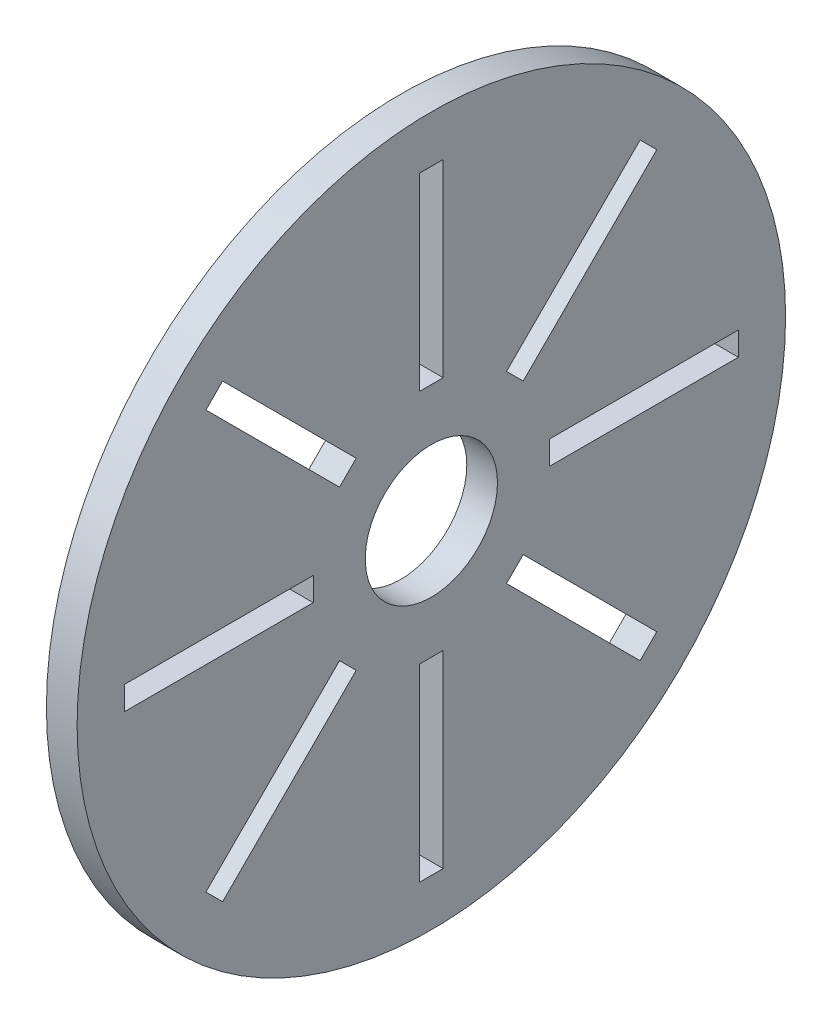
from build123d import *

# Parameters (mm, degrees)
SKETCH1_R           = 15
BOSS_EXTRUDE1_DEPTH = 1.3
SKETCH2_R           = 2.8
CUT_EXTRUDE1_DEPTH  = 22.252999788
SKETCH3_W           = 1
SKETCH3_H           = 8
SKETCH3_W_2         = 8
SKETCH3_H_2         = 1
CUT_EXTRUDE2_DEPTH  = 22.252999788


with BuildPart() as part:
    # Sketch1 → Boss-Extrude1 (new body)
    with BuildSketch(Plane(origin=(0, 0, 0), x_dir=(0, 0, -1), z_dir=(1, 0, 0))):
        Circle(SKETCH1_R)
    extrude(amount=BOSS_EXTRUDE1_DEPTH)

    # Sketch2 → Cut-Extrude1 (cut, through all)
    with BuildSketch(Plane(origin=(1.3, 0, 0), x_dir=(0, 0, -1), z_dir=(1, 0, 0))):
        Circle(SKETCH2_R)
    extrude(amount=-CUT_EXTRUDE1_DEPTH, mode=Mode.SUBTRACT)

    # Sketch3 → Cut-Extrude2 (cut, through all)
    with BuildSketch(Plane(origin=(1.3, 0, 0), x_dir=(0, 0, -1), z_dir=(1, 0, 0))):
        Polygon((-8.838834765, -9.545941546), (-3.181980515, -3.889087297), (-3.889087297, -3.181980515), (-9.545941546, -8.838834765), align=None)
        Polygon((9.545941546, -8.838834765), (3.889087297, -3.181980515), (3.181980515, -3.889087297), (8.838834765, -9.545941546), align=None)
        Polygon((-9.545941546, 8.838834765), (-3.889087297, 3.181980515), (-3.181980515, 3.889087297), (-8.838834765, 9.545941546), align=None)
        Polygon((9.545941546, 8.838834765), (3.889087297, 3.181980515), (3.181980515, 3.889087297), (8.838834765, 9.545941546), align=None)
        with Locations((0, 9)):
            Rectangle(SKETCH3_W, SKETCH3_H)
        with Locations((9, 0)):
            Rectangle(SKETCH3_W_2, SKETCH3_H_2)
        with Locations((0, -9)):
            Rectangle(SKETCH3_W, SKETCH3_H)
        with Locations((-9, 0)):
            Rectangle(SKETCH3_W_2, SKETCH3_H_2)
    extrude(amount=-CUT_EXTRUDE2_DEPTH, mode=Mode.SUBTRACT)


solid = part.part
